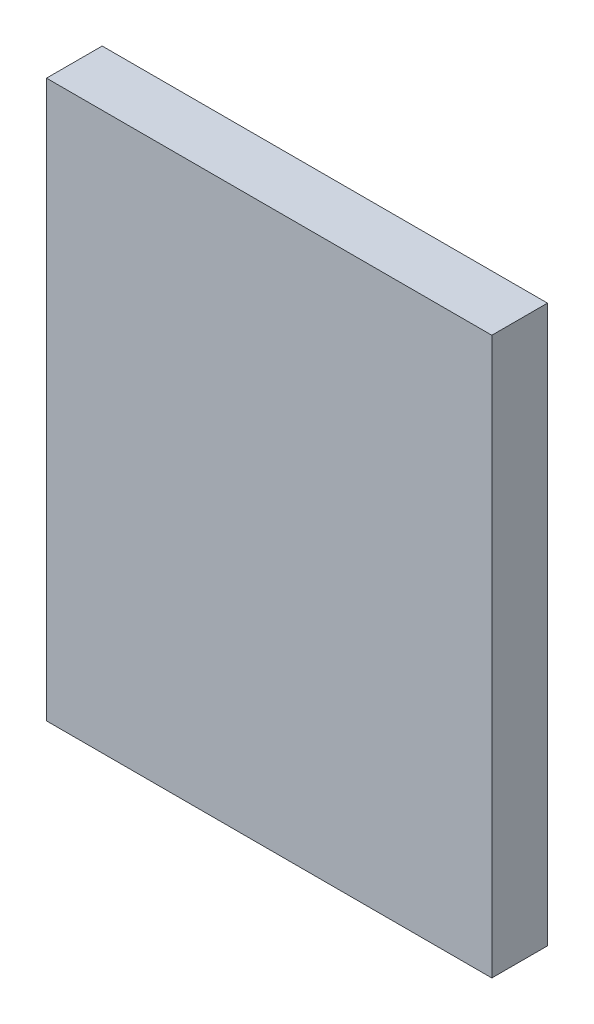
from build123d import *

# Parameters (mm, degrees)
SKETCH1_W           = 203.2
SKETCH1_H           = 25.4
BOSS_EXTRUDE1_DEPTH = 254


with BuildPart() as part:
    # Sketch1 → Boss-Extrude1 (new body)
    with BuildSketch(Plane(origin=(0, 0, 0), x_dir=(1, 0, 0), z_dir=(0, 1, 0))):
        Rectangle(SKETCH1_W, SKETCH1_H)
    extrude(amount=BOSS_EXTRUDE1_DEPTH)


solid = part.part
